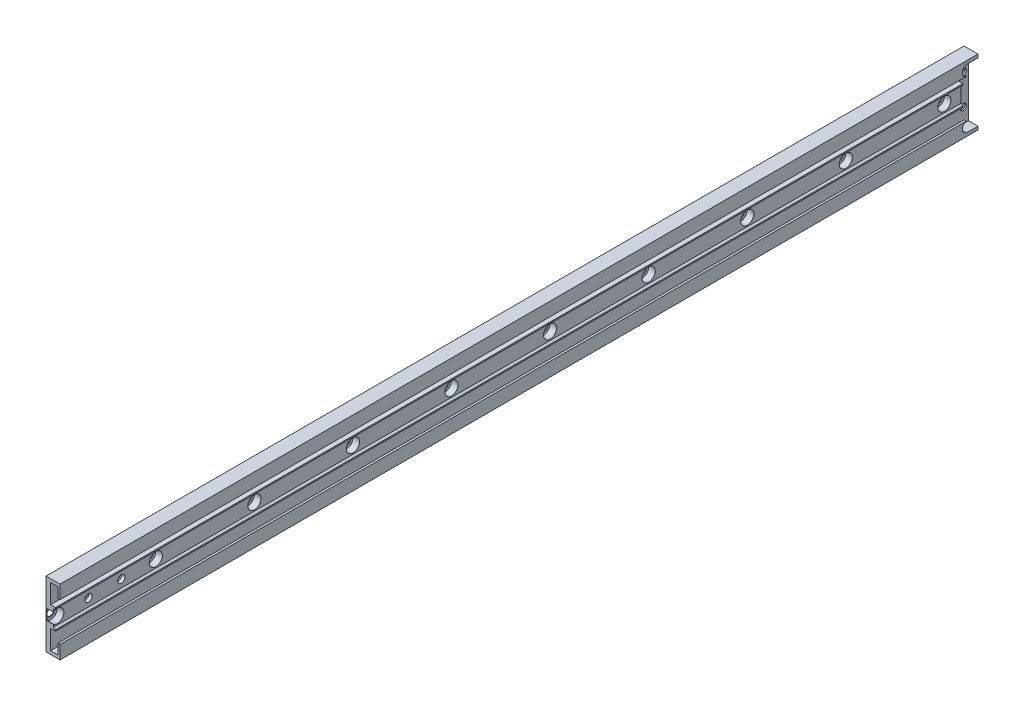
from build123d import *

# Parameters (mm, degrees)
BOSS_EXTRUDE1_DEPTH                             = 281.94
BOSS_EXTRUDE1_DEPTH_BACK                        = 276.86
CBORE_FOR_M4_SHCS1_D                            = 4.5
CBORE_FOR_M4_SHCS1_CBORE_D                      = 8
CBORE_FOR_M4_SHCS1_CBORE_DEPTH                  = 4
CSK_FOR_M4_FLAT_HEAD_MACHINE_SCREW1_D           = 4.5
CSK_FOR_M4_FLAT_HEAD_MACHINE_SCREW1_CSINK_D     = 9.4
CSK_FOR_M4_FLAT_HEAD_MACHINE_SCREW1_CSINK_ANGLE = 90
LPATTERN1_COUNT                                 = 9
LPATTERN1_PITCH                                 = 60
LPATTERN1_COL_COUNT                             = 2
LPATTERN1_COL_PITCH                             = 60
CSK_FOR_6_FLAT_HEAD_MACHINE_SCREW1_D            = 3.7973
CSK_FOR_6_FLAT_HEAD_MACHINE_SCREW1_CSINK_D      = 7.0866
CSK_FOR_6_FLAT_HEAD_MACHINE_SCREW1_CSINK_ANGLE  = 82
CUT_EXTRUDE1_START                              = -5.775
CUT_EXTRUDE1_DEPTH                              = 5.775


with BuildPart() as part:
    # Sketch1 → Boss-Extrude1 (new, two sides: drawn at the far end of the back side and taken through both)
    with BuildSketch(Plane.XY.offset(-BOSS_EXTRUDE1_DEPTH_BACK)):
        Polygon((-39.1, 20), (-39.1, 11.75), (-40.375, 11.75), (-40.375, 18), (-44.875, 18), (-44.875, 6.25), (-41.875, 6.25), (-41.875, 5.5), (-43.125, 4.778312164), (-43.125, -4.778312164), (-41.875, -5.5), (-41.875, -6.25), (-44.875, -6.25), (-44.875, -18), (-40.375, -18), (-40.375, -11.75), (-39.1, -11.75), (-39.1, -20), (-47.625, -20), (-47.625, 20), align=None)
    extrude(amount=BOSS_EXTRUDE1_DEPTH + BOSS_EXTRUDE1_DEPTH_BACK)

    # CBORE for M4 SHCS1 (through all)
    with Locations(Plane(origin=(-43.125, 0, 0), x_dir=(0, 0, -1), z_dir=(1, 0, 0))):
        with Locations((-219.589999986, 0)):
            cbore_for_m4_shcs1 = CounterBoreHole(CBORE_FOR_M4_SHCS1_D / 2, CBORE_FOR_M4_SHCS1_CBORE_D / 2, CBORE_FOR_M4_SHCS1_CBORE_DEPTH)

    # CSK for M4 Flat Head Machine Screw1 (through all)
    with Locations(Plane(origin=(-47.625, 6.680483291, -0.93803287), x_dir=(0, 0, -1), z_dir=(-1, 0, 0))):
        with Locations((-241.52803302, 6.680483291), (-261.528032898, 6.680483291)):
            CounterSinkHole(CSK_FOR_M4_FLAT_HEAD_MACHINE_SCREW1_D / 2, CSK_FOR_M4_FLAT_HEAD_MACHINE_SCREW1_CSINK_D / 2, counter_sink_angle=CSK_FOR_M4_FLAT_HEAD_MACHINE_SCREW1_CSINK_ANGLE)

    # LPattern1: CBORE for M4 SHCS1 ×9
    with Locations(*[(0, 0, -i * LPATTERN1_PITCH) for i in range(1, LPATTERN1_COUNT)]):
        add(cbore_for_m4_shcs1, mode=Mode.SUBTRACT)

    # LPattern1 col: CBORE for M4 SHCS1 ×2
    with Locations(*[(0, 0, i * LPATTERN1_COL_PITCH) for i in range(1, LPATTERN1_COL_COUNT)]):
        add(cbore_for_m4_shcs1, mode=Mode.SUBTRACT)

    # CSK for #6 Flat Head Machine Screw1 (through all)
    with Locations(Plane(origin=(-47.625, 11.960142778, 21.111442158), x_dir=(0, 0, -1), z_dir=(-1, 0, 0))):
        with Locations((294.796442158, 21.210142874), (294.796442158, 2.710142682)):
            CounterSinkHole(CSK_FOR_6_FLAT_HEAD_MACHINE_SCREW1_D / 2, CSK_FOR_6_FLAT_HEAD_MACHINE_SCREW1_CSINK_D / 2, counter_sink_angle=CSK_FOR_6_FLAT_HEAD_MACHINE_SCREW1_CSINK_ANGLE)

    # Sketch8 → Cut-Extrude1 (cut)
    with BuildSketch(Plane(origin=(-39.1, 0, 0), x_dir=(0, 0, -1), z_dir=(1, 0, 0)).offset(CUT_EXTRUDE1_START)):
        with BuildLine():
            Line((271.300569415, -11.75), (276.86, -11.75))
            Line((276.86, -11.75), (276.86, 18))
            Line((276.86, 18), (270.51, 18))
            ThreePointArc((270.51, 18), (272.75506403, 17.07006403), (273.685, 14.825))
            ThreePointArc((273.685, 14.825), (272.75506403, 12.57993597), (270.51, 11.65))
            Line((270.51, 11.65), (270.51, -11.65))
            ThreePointArc((270.51, -11.65), (270.908434436, -11.675099208), (271.300569415, -11.75))
        make_face()
        with BuildLine():
            Line((270.51, -18), (276.86, -18))
            Line((276.86, -18), (276.86, -11.75))
            Line((276.86, -11.75), (271.300569415, -11.75))
            ThreePointArc((271.300569415, -11.75), (273.019051902, -12.879419482), (273.685, -14.825))
            ThreePointArc((273.685, -14.825), (272.75506403, -17.07006403), (270.51, -18))
        make_face()
        with BuildLine():
            ThreePointArc((269.719430585, -11.75), (267.360099208, -15.223434436), (270.51, -18))
            Line((270.51, -18), (270.51, -11.75))
            Line((270.51, -11.75), (269.719430585, -11.75))
        make_face()
        with BuildLine():
            Line((270.51, -11.75), (270.51, -18))
            ThreePointArc((270.51, -18), (272.75506403, -17.07006403), (273.685, -14.825))
            ThreePointArc((273.685, -14.825), (273.019051902, -12.879419482), (271.300569415, -11.75))
            Line((271.300569415, -11.75), (270.51, -11.75))
        make_face()
        with BuildLine():
            Line((269.719430585, -11.75), (270.51, -11.75))
            Line((270.51, -11.75), (270.51, -11.65))
            ThreePointArc((270.51, -11.65), (270.111565564, -11.675099208), (269.719430585, -11.75))
        make_face()
        with BuildLine():
            Line((270.51, -11.65), (270.51, -11.75))
            Line((270.51, -11.75), (271.300569415, -11.75))
            ThreePointArc((271.300569415, -11.75), (270.908434436, -11.675099208), (270.51, -11.65))
        make_face()
        with BuildLine():
            ThreePointArc((273.685, 14.825), (272.75506403, 17.07006403), (270.51, 18))
            Line((270.51, 18), (270.51, 11.65))
            ThreePointArc((270.51, 11.65), (272.75506403, 12.57993597), (273.685, 14.825))
        make_face()
        with BuildLine():
            Line((270.51, 11.65), (270.51, 18))
            ThreePointArc((270.51, 18), (267.335, 14.825), (270.51, 11.65))
        make_face()
    extrude(amount=CUT_EXTRUDE1_DEPTH, mode=Mode.SUBTRACT)


solid = part.part
